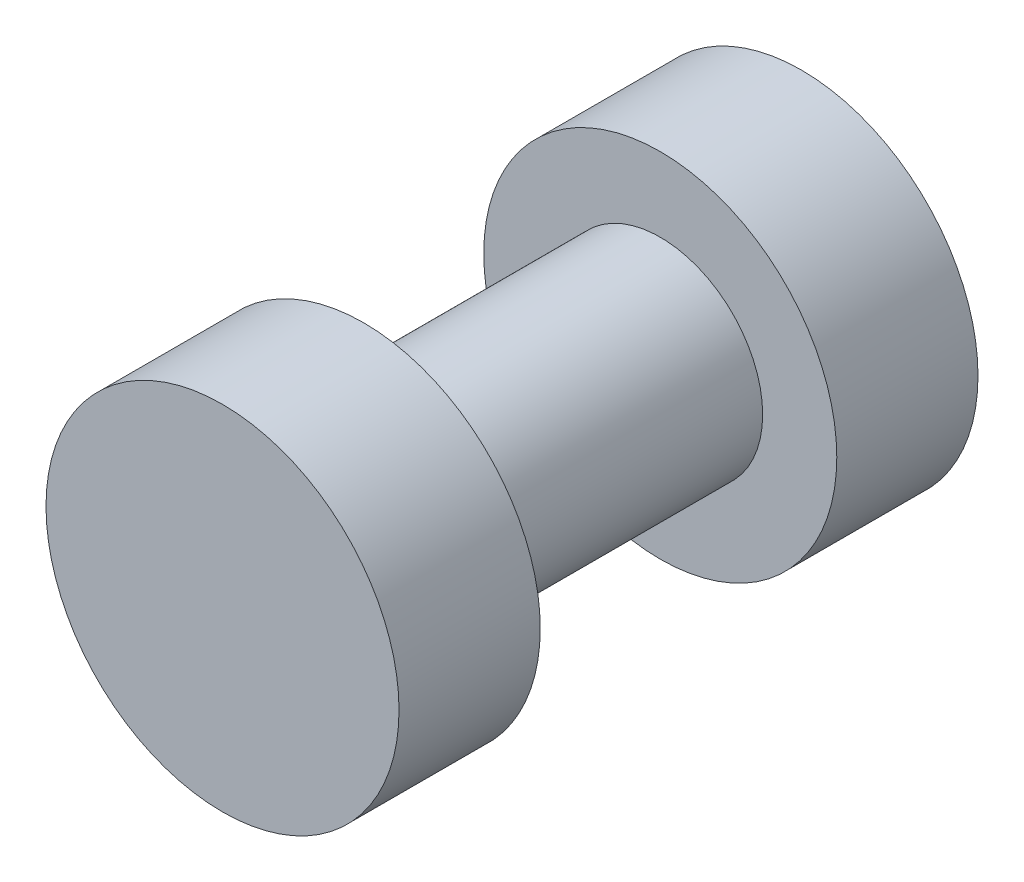
from build123d import *

# Parameters (mm, degrees)
SKETCH1_R           = 12.5
BOSS_EXTRUDE1_DEPTH = 10
SKETCH3_R           = 7.25
BOSS_EXTRUDE2_DEPTH = 21
SKETCH4_R           = 12.5
BOSS_EXTRUDE3_DEPTH = 10


with BuildPart() as part:
    # Sketch1 → Boss-Extrude1 (new body)
    with BuildSketch(Plane.XY):
        Circle(SKETCH1_R)
    extrude(amount=BOSS_EXTRUDE1_DEPTH)

    # Sketch3 → Boss-Extrude2 (add)
    with BuildSketch(Plane.XY.offset(10)):
        with Locations(Location((0, 0, 0), (0, 0, 180))):
            Circle(SKETCH3_R)
    extrude(amount=BOSS_EXTRUDE2_DEPTH)

    # Sketch4 → Boss-Extrude3 (add)
    with BuildSketch(Plane.XY.offset(31)):
        Circle(SKETCH4_R)
    extrude(amount=BOSS_EXTRUDE3_DEPTH)


solid = part.part
